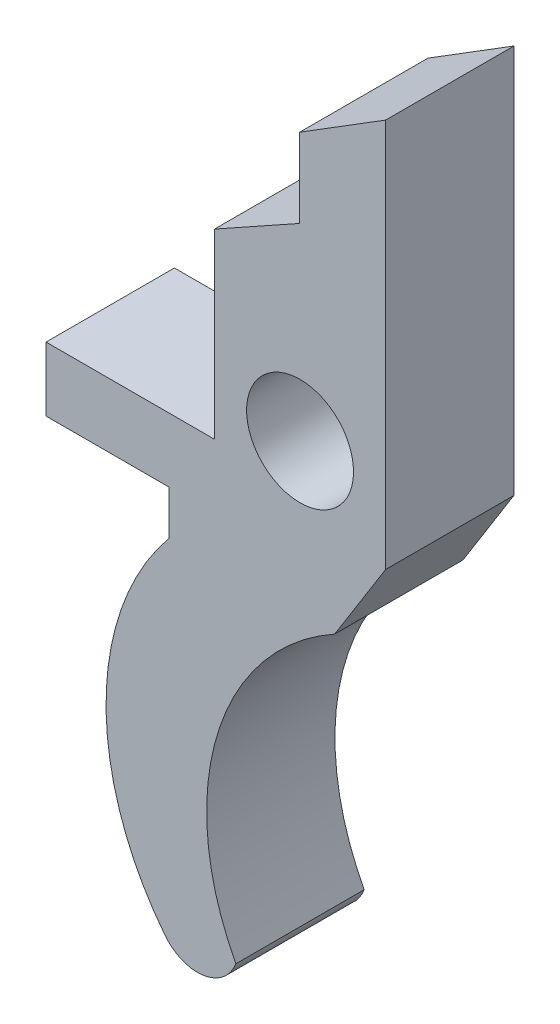
from build123d import *

# Parameters (mm, degrees)
SKETCH_1_R      = 4
SKETCH_1_R_2    = 2.5
EXTRUDE_1_DEPTH = 6


with BuildPart() as part:
    # 스케치1 → 보스-돌출1 (new body)
    # profile 1 of 4: a face of its own
    with BuildSketch(Plane.XY):
        with BuildLine():
            Line((4, -3.202328983), (4, 0))
            ThreePointArc((4, 0), (-3e-09, -4), (-4, 6e-09))
            Line((-4, 6e-09), (-4, -1.928017797))
            Line((-4, -1.928017797), (-11.877068301, -1.928017797))
            Line((-11.877068301, -1.928017797), (-11.877068301, -4.928017797))
            Line((-11.877068301, -4.928017797), (-6.12956889, -4.928017797))
            Line((-6.12956889, -4.928017797), (-6.12956889, -7.005884989))
            Line((-6.12956889, -7.005884989), (1.618982626, -7.005884989))
            Line((1.618982626, -7.005884989), (4, -3.202328983))
        make_face()
    # profile 2 of 4: a face of its own
    with BuildSketch(Plane.XY):
        Circle(SKETCH_1_R)
        Circle(SKETCH_1_R_2, mode=Mode.SUBTRACT)
    # profile 3 of 4: a face of its own
    with BuildSketch(Plane.XY):
        with BuildLine():
            Line((4, 15), (-0.018657753, 12.499853249))
            Line((-0.018657753, 12.499853249), (-0.018657753, 8.804925293))
            Line((-0.018657753, 8.804925293), (-4, 6.585919306))
            Line((-4, 6.585919306), (-4, 6e-09))
            ThreePointArc((-4, 6e-09), (3e-09, 4), (4, 0))
            Line((4, 0), (4, 15))
        make_face()
    # profile 4 of 4: a face of its own
    with BuildSketch(Plane.XY):
        with BuildLine():
            ThreePointArc((-6.12956889, -7.005884989), (-9.072577994, -15.066190234), (-6.302707776, -23.187621278))
            ThreePointArc((-6.302707776, -23.187621278), (-4.499421911, -23.894054073), (-2.999999998, -22.668239597))
            ThreePointArc((-2.999999998, -22.668239597), (-3.892893232, -13.892647551), (1.618982626, -7.005884989))
            Line((1.618982626, -7.005884989), (-6.12956889, -7.005884989))
        make_face()
    extrude(amount=EXTRUDE_1_DEPTH)


solid = part.part
